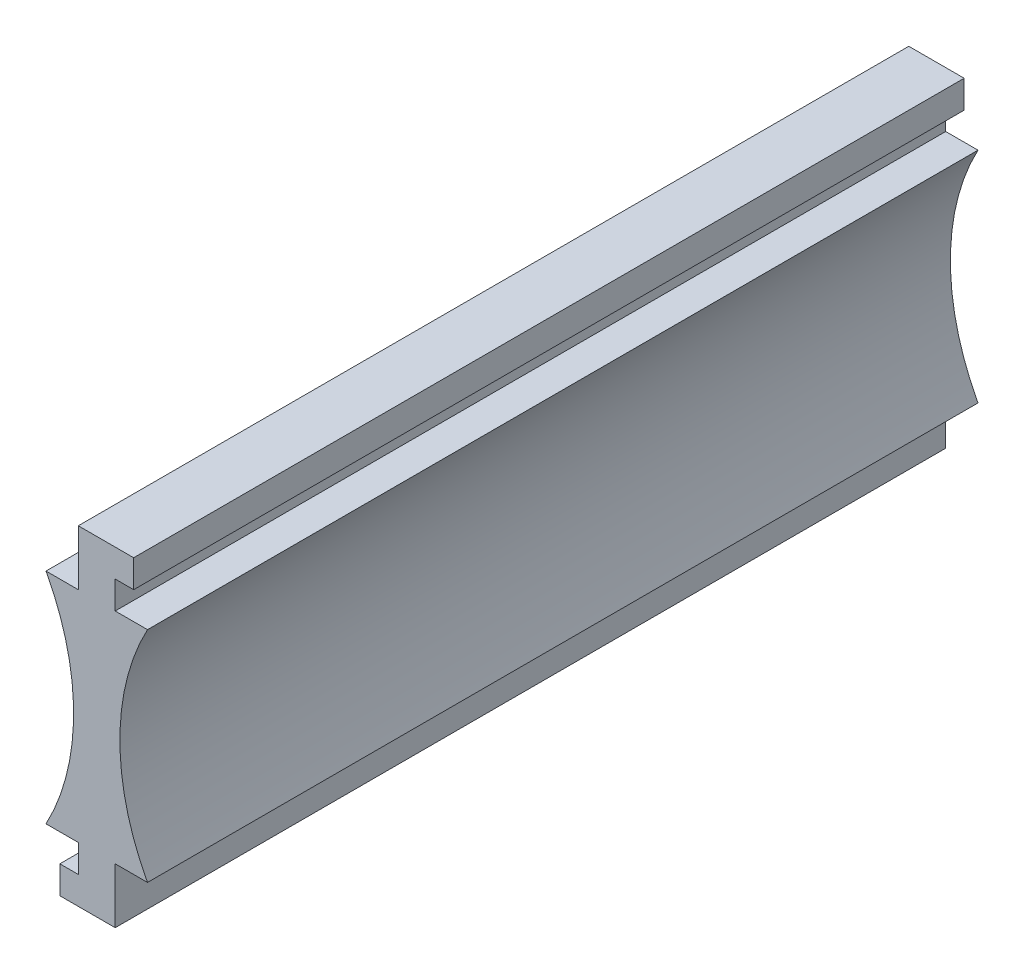
from build123d import *

# Parameters (mm, degrees)
EXTRUDE_1_DEPTH = 180


with BuildPart() as part:
    # Эскиз1 → Бобышка-Вытянуть1 (new body)
    with BuildSketch(Plane.XY):
        with BuildLine():
            Line((-11, -23.725), (-4, -23.725))
            Line((-4, -23.725), (-4, -29.725))
            Line((-4, -29.725), (-8, -29.725))
            Line((-8, -29.725), (-8, -35.725))
            Line((-8, -35.725), (4, -35.725))
            Line((4, -35.725), (4, -23.725))
            Line((4, -23.725), (11, -23.725))
            ThreePointArc((11, -23.725), (5.012775134, 0), (11, 23.725))
            Line((11, 23.725), (4, 23.725))
            Line((4, 23.725), (4, 29.725))
            Line((4, 29.725), (8, 29.725))
            Line((8, 29.725), (8, 35.725))
            Line((8, 35.725), (-4, 35.725))
            Line((-4, 35.725), (-4, 23.725))
            Line((-4, 23.725), (-11, 23.725))
            ThreePointArc((-11, 23.725), (-5.012775134, 0), (-11, -23.725))
        make_face()
    extrude(amount=-EXTRUDE_1_DEPTH)


solid = part.part
